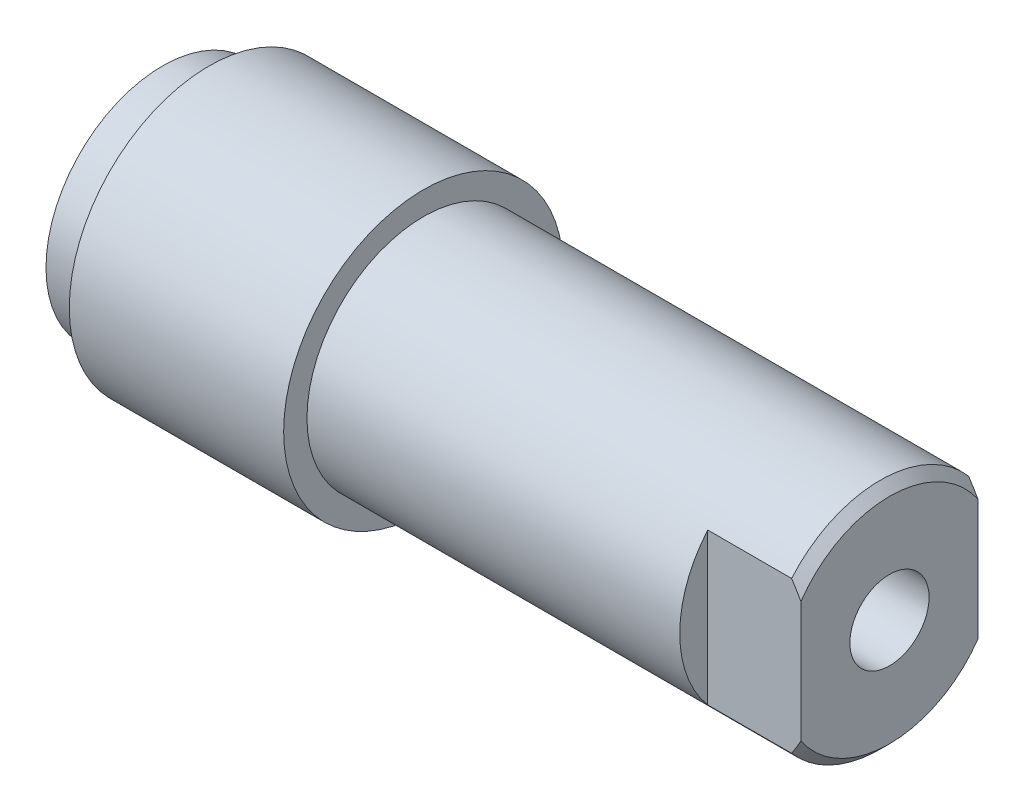
from build123d import *

# Parameters (mm, degrees)
SKETCH_2_W          = 4.5
SKETCH_2_H          = 28
CUT_EXTRUDE_1_DEPTH = 10
SKETCH_3_R          = 4.25
CUT_EXTRUDE_2_DEPTH = 20


with BuildPart() as part:
    # ｽｹｯﾁ1 → 回転1 (revolve)
    with BuildSketch(Plane.XY, mode=Mode.PRIVATE) as revolve_1_sk:
        Polygon((-78, 0), (-78, 12.5), (-73, 12.5), (-73, 15), (-50, 15), (-50, 12.5), (-1, 12.5), (0, 11.5), (0, 0), align=None)
    revolve(revolve_1_sk.sketch.rotate(Axis((-78, 0, 0), (1, 0, 0)), 90), axis=Axis((-78, 0, 0), (1, 0, 0)))

    # ｽｹｯﾁ2 → ｶｯﾄ - 押し出し1 (cut)
    with BuildSketch(Plane(origin=(0, 0, 0), x_dir=(0, 0, -1), z_dir=(1, 0, 0))):
        with Locations((11.75, 0)):
            Rectangle(SKETCH_2_W, SKETCH_2_H)
        with Locations((-11.75, 0)):
            Rectangle(SKETCH_2_W, SKETCH_2_H)
    extrude(amount=-CUT_EXTRUDE_1_DEPTH, mode=Mode.SUBTRACT)

    # ｽｹｯﾁ3 → ｶｯﾄ - 押し出し2 (cut)
    with BuildSketch(Plane(origin=(0, 0, 0), x_dir=(0, 0, -1), z_dir=(1, 0, 0))):
        Circle(SKETCH_3_R)
    extrude(amount=-CUT_EXTRUDE_2_DEPTH, mode=Mode.SUBTRACT)


solid = part.part
